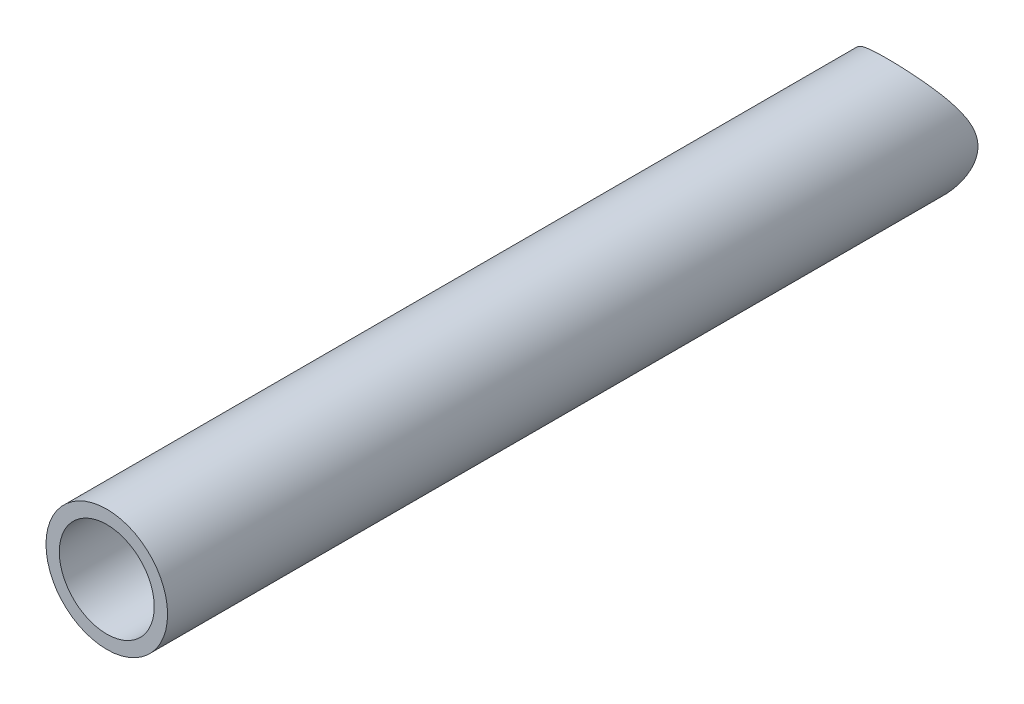
from build123d import *

# Parameters (mm, degrees)
SKETCH1_R               = 13.335
SKETCH1_R_2             = 10.414
BOSS_EXTRUDE1_DEPTH     = 177.8
CUT_EXTRUDE1_DEPTH      = 179.79732786
CUT_EXTRUDE1_DEPTH_BACK = 179.79732786


with BuildPart() as part:
    # Sketch1 → Boss-Extrude1 (new body)
    with BuildSketch(Plane.XY):
        Circle(SKETCH1_R)
        Circle(SKETCH1_R_2, mode=Mode.SUBTRACT)
    extrude(amount=BOSS_EXTRUDE1_DEPTH)

    # Sketch2 → Cut-Extrude1 (cut, two sides: drawn at the far end of the back side and taken through both)
    with BuildSketch(Plane(origin=(0, 0, 0), x_dir=(1, 0, 0), z_dir=(0, 1, 0)).offset(-CUT_EXTRUDE1_DEPTH_BACK)):
        with BuildLine():
            Line((-13.335, 0), (13.335, 0))
            ThreePointArc((13.335, 0), (0, -6.604793781), (-13.335, 0))
        make_face()
    extrude(amount=CUT_EXTRUDE1_DEPTH + CUT_EXTRUDE1_DEPTH_BACK, mode=Mode.SUBTRACT)


solid = part.part
